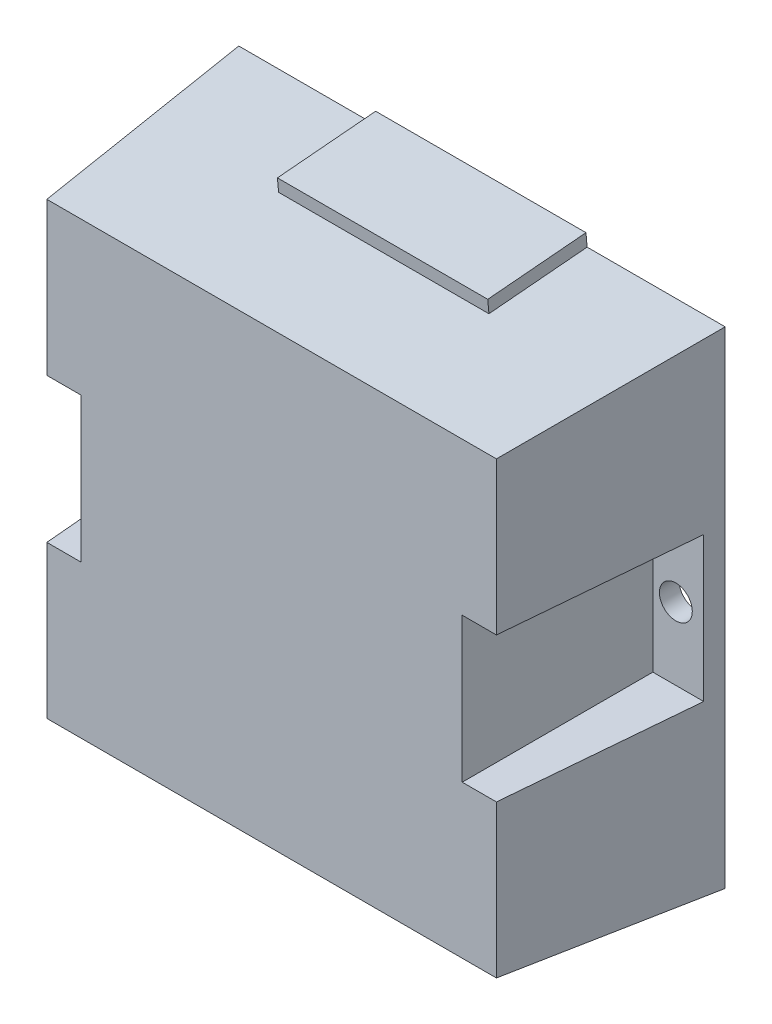
from build123d import *

# Parameters (mm, degrees)
ESQUISSE1_W             = 74
ESQUISSE1_H             = 74
BOSS_EXTRU_1_DEPTH      = 32
BOSS_EXTRU_1_TAPER      = 5
ESQUISSE2_W             = 19.942710043
ESQUISSE2_H             = 22
ESQUISSE2_W_2           = 15.933949428
ENL_V_MAT_EXTRU_1_DEPTH = 29
ESQUISSE3_R             = 2.5
ENL_V_MAT_EXTRU_2_DEPTH = 10
ESQUISSE5_W             = 32
ESQUISSE5_H             = 15
BOSS_EXTRU_2_DEPTH      = 2


with BuildPart() as part:
    # Esquisse1 → Boss.-Extru.1 (new body)
    with BuildSketch(Plane.XY):
        with Locations((-135.106350006, 30.682970669)):
            Rectangle(ESQUISSE1_W, ESQUISSE1_H)
    extrude(amount=BOSS_EXTRU_1_DEPTH, taper=BOSS_EXTRU_1_TAPER)

    # Esquisse2 → Enlèv. mat.-Extru.1 (cut)
    with BuildSketch(Plane.XY.offset(32)):
        with Locations((-174.077705028, 30.682970669)):
            Rectangle(ESQUISSE2_W, ESQUISSE2_H)
        with Locations((-98.139375292, 30.682970669)):
            Rectangle(ESQUISSE2_W_2, ESQUISSE2_H)
    extrude(amount=-ENL_V_MAT_EXTRU_1_DEPTH, mode=Mode.SUBTRACT)

    # Esquisse3 → Enlèv. mat.-Extru.2 (cut)
    with BuildSketch(Plane.XY.offset(3)):
        with Locations((-167.606350006, 30.682970669)):
            Circle(ESQUISSE3_R)
        with Locations((-102.606350006, 30.682970669)):
            Circle(ESQUISSE3_R)
    extrude(amount=-ENL_V_MAT_EXTRU_2_DEPTH, mode=Mode.SUBTRACT)

    # Esquisse5 → Boss.-Extru.2 (add)
    with BuildSketch(Plane(origin=(0, 67.168842465, 5.876512258), x_dir=(1, 0, 0), z_dir=(0, 0.9961946980917457, 0.08715574274765837))):
        with Locations((-135.106350006, -1.60104042)):
            Rectangle(ESQUISSE5_W, ESQUISSE5_H)
    extrude(amount=BOSS_EXTRU_2_DEPTH)


solid = part.part
